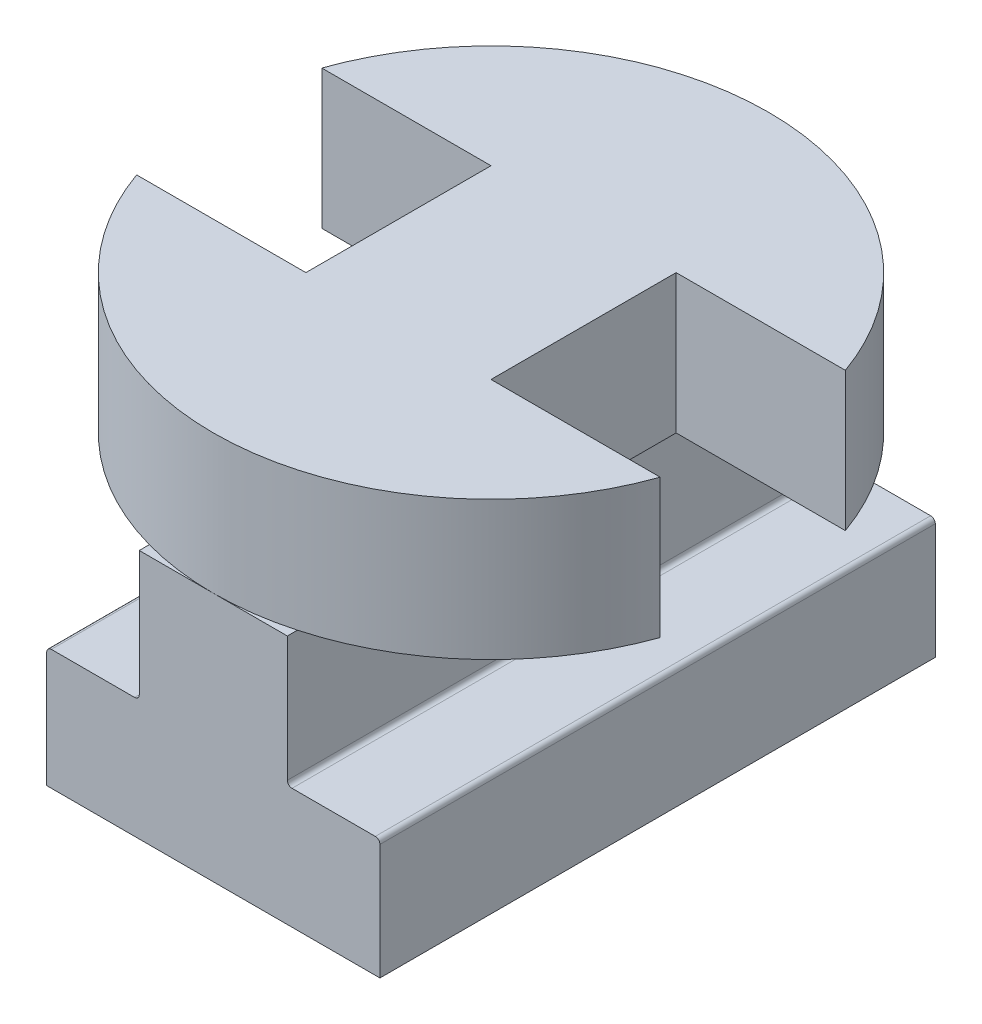
from build123d import *

# Parameters (mm, degrees)
BOSS_EXTRUDE1_DEPTH = 6
BOSS_EXTRUDE2_DEPTH = 1.5
FILLET6_R           = 0.05


with BuildPart() as part:
    # Sketch2 → Boss-Extrude1 (new body)
    with BuildSketch(Plane.XY):
        Polygon((-0.8, 2.7), (0.8, 2.7), (0.8, 1.3), (1.8, 1.3), (1.8, 0), (-1.8, 0), (-1.8, 1.3), (-0.8, 1.3), align=None)
    extrude(amount=BOSS_EXTRUDE1_DEPTH)

    # Sketch3 → Boss-Extrude2 (add)
    with BuildSketch(Plane(origin=(0, 2.7, 0), x_dir=(1, 0, 0), z_dir=(0, 1, 0))):
        with BuildLine():
            ThreePointArc((0.8, -0.108633541), (0, 0), (-0.8, -0.108633541))
            Line((-0.8, -0.108633541), (-0.8, -5.891366459))
            ThreePointArc((-0.8, -5.891366459), (0, -6), (0.8, -5.891366459))
            Line((0.8, -5.891366459), (0.8, -0.108633541))
        make_face()
        with BuildLine():
            Line((-2.828427125, -2), (-1, -2))
            Line((-1, -2), (-1, -4))
            Line((-1, -4), (-2.828427125, -4))
            ThreePointArc((-2.828427125, -4), (-2.04589531, -5.194154138), (-0.8, -5.891366459))
            Line((-0.8, -5.891366459), (-0.8, -0.108633541))
            ThreePointArc((-0.8, -0.108633541), (-2.04589531, -0.805845862), (-2.828427125, -2))
        make_face()
        with BuildLine():
            ThreePointArc((2.828427125, -2), (2.04589531, -0.805845862), (0.8, -0.108633541))
            Line((0.8, -0.108633541), (0.8, -5.891366459))
            ThreePointArc((0.8, -5.891366459), (2.04589531, -5.194154138), (2.828427125, -4))
            Line((2.828427125, -4), (1, -4))
            Line((1, -4), (1, -2))
            Line((1, -2), (2.828427125, -2))
        make_face()
    extrude(amount=BOSS_EXTRUDE2_DEPTH)

    # Fillet6
    fillet6_edges = [part.edges().sort_by_distance(p)[0] for p in [
        (0.8, 1.3, 3),
        (1.8, 1.3, 3),
        (-1.8, 1.3, 3),
        (-0.8, 1.3, 3),
    ]]
    fillet(fillet6_edges, radius=FILLET6_R)


solid = part.part
